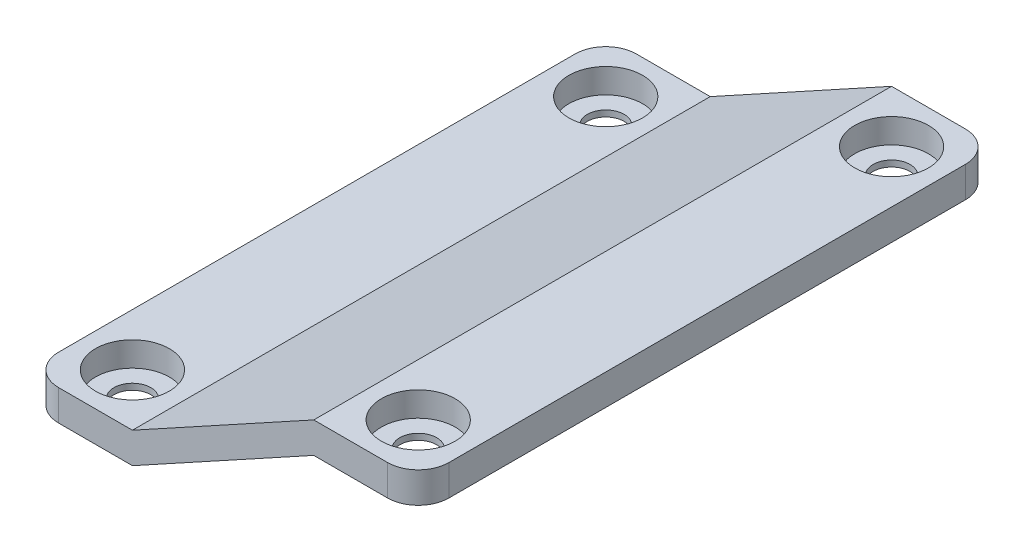
from build123d import *

# Parameters (mm, degrees)
COVER_BODY_DEPTH                        = 94
CBORE_FOR_M6_HEX_HEAD_BOLT1_D           = 6
CBORE_FOR_M6_HEX_HEAD_BOLT1_CBORE_D     = 12
CBORE_FOR_M6_HEX_HEAD_BOLT1_CBORE_DEPTH = 4
CBORE_FOR_M6_HEX_HEAD_BOLT2_D           = 6
CBORE_FOR_M6_HEX_HEAD_BOLT2_CBORE_D     = 12
CBORE_FOR_M6_HEX_HEAD_BOLT2_CBORE_DEPTH = 4
FILLET1_R                               = 5


with BuildPart() as part:
    # Sketch1 → Cover Body (new body)
    with BuildSketch(Plane.XY):
        Polygon((-15.007754177, -4.568983292), (14.492245823, 11.631016708), (31.492245823, 11.631016708), (31.492245823, 6.631016708), (14.492245823, 6.631016708), (-15.007754177, -9.568983292), (-32.007754177, -9.568983292), (-32.007754177, -4.568983292), align=None)
    extrude(amount=-COVER_BODY_DEPTH)

    # CBORE for M6 Hex Head Bolt1 (through all)
    with Locations(Plane(origin=(0, -4.568983292, 0), x_dir=(1, 0, 0), z_dir=(0, 1, 0))):
        with Locations((-23.507754177, 85.5), (-23.507754177, 8.5)):
            CounterBoreHole(CBORE_FOR_M6_HEX_HEAD_BOLT1_D / 2, CBORE_FOR_M6_HEX_HEAD_BOLT1_CBORE_D / 2, CBORE_FOR_M6_HEX_HEAD_BOLT1_CBORE_DEPTH)

    # CBORE for M6 Hex Head Bolt2 (through all)
    with Locations(Plane(origin=(0, 11.631016708, 0), x_dir=(1, 0, 0), z_dir=(0, 1, 0))):
        with Locations((22.992245823, 8.5), (22.992245823, 85.5)):
            CounterBoreHole(CBORE_FOR_M6_HEX_HEAD_BOLT2_D / 2, CBORE_FOR_M6_HEX_HEAD_BOLT2_CBORE_D / 2, CBORE_FOR_M6_HEX_HEAD_BOLT2_CBORE_DEPTH)

    # Fillet1
    fillet1_edges = [part.edges().sort_by_distance(p)[0] for p in [
        (31.492245823, 9.131016708, 0),
        (31.492245823, 9.131016708, -94),
        (-32.007754177, -7.068983292, -94),
        (-32.007754177, -7.068983292, 0),
    ]]
    fillet(fillet1_edges, radius=FILLET1_R)


solid = part.part
